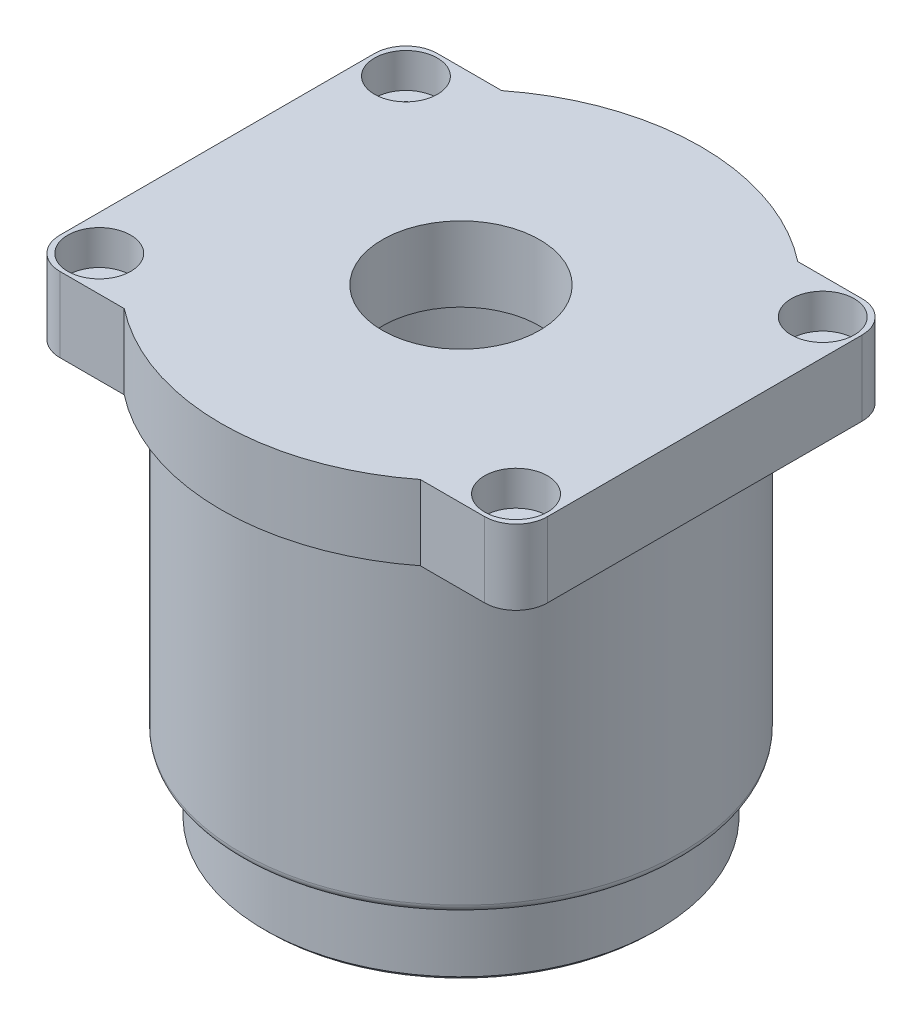
from build123d import *

# Parameters (mm, degrees)
SKICA1_R                                         = 10
P_IDAT_VYSUNUT_M1_DEPTH                          = 9.5
V_LCOV_ZAHLOUBEN_PRO_M4_ROUBY_S_VNIT_D           = 4.5
V_LCOV_ZAHLOUBEN_PRO_M4_ROUBY_S_VNIT_CBORE_D     = 8
V_LCOV_ZAHLOUBEN_PRO_M4_ROUBY_S_VNIT_CBORE_DEPTH = 4.4
LINPOLE1_COUNT                                   = 2
LINPOLE1_PITCH                                   = 53
LINPOLE1_COUNT_DIR2                              = 2
LINPOLE1_PITCH_DIR2                              = 39
SKICA4_R                                         = 28
SKICA4_R_2                                       = 20
P_IDAT_VYSUNUT_M2_DEPTH                          = 40
ZAOBLIT1_R                                       = 0.5
SKICA5_R                                         = 25
SKICA5_R_2                                       = 12.5
P_IDAT_VYSUNUT_M3_DEPTH                          = 9.5
ZAOBLIT2_R                                       = 1
ZKOSEN_1_SIZE                                    = 0.5
ODEBRAT_START                                    = -0.5
SKICA7_R                                         = 20
ODEBRAT_VYSUNUT_M1_DEPTH                         = 0.5
ZAOBLIT3_R                                       = 0.25


with BuildPart() as part:
    # Skica1 → Přidat vysunutím1 (new body)
    with BuildSketch(Plane(origin=(0, 0, 0), x_dir=(1, 0, 0), z_dir=(0, 1, 0))):
        with BuildLine():
            Line((-27, 24), (-18.821530225, 24))
            ThreePointArc((-18.821530225, 24), (0, 30.5), (18.821530225, 24))
            Line((18.821530225, 24), (27, 24))
            ThreePointArc((27, 24), (29.828427125, 22.828427125), (31, 20))
            Line((31, 20), (31, -20))
            ThreePointArc((31, -20), (29.828427125, -22.828427125), (27, -24))
            Line((27, -24), (18.821530225, -24))
            ThreePointArc((18.821530225, -24), (0, -30.5), (-18.821530225, -24))
            Line((-18.821530225, -24), (-27, -24))
            ThreePointArc((-27, -24), (-29.828427125, -22.828427125), (-31, -20))
            Line((-31, -20), (-31, 20))
            ThreePointArc((-31, 20), (-29.828427125, 22.828427125), (-27, 24))
        make_face()
        with Locations(Location((0, 0, 0), (0, 0, 270))):
            Circle(SKICA1_R, mode=Mode.SUBTRACT)
    extrude(amount=-P_IDAT_VYSUNUT_M1_DEPTH)

    # Válcové zahloubení pro M4 šrouby s vnitřním šestihranem1 (through all)
    with Locations(Plane(origin=(0, 0, 0), x_dir=(1, 0, 0), z_dir=(0, 1, 0))):
        with Locations((26.5, -19.5)):
            v_lcov_zahlouben_pro_m4_rouby_s_vnit = CounterBoreHole(V_LCOV_ZAHLOUBEN_PRO_M4_ROUBY_S_VNIT_D / 2, V_LCOV_ZAHLOUBEN_PRO_M4_ROUBY_S_VNIT_CBORE_D / 2, V_LCOV_ZAHLOUBEN_PRO_M4_ROUBY_S_VNIT_CBORE_DEPTH)

    # LinPole1: V_lcov_ zahlouben_ pro M4 _rouby s vnit 2 × 2
    with Locations(*[(-i * LINPOLE1_PITCH, 0, -j * LINPOLE1_PITCH_DIR2) for i in range(LINPOLE1_COUNT) for j in range(LINPOLE1_COUNT_DIR2) if (i, j) != (0, 0)]):
        add(v_lcov_zahlouben_pro_m4_rouby_s_vnit, mode=Mode.SUBTRACT)

    # Skica4 → Přidat vysunutím2 (add)
    with BuildSketch(Plane.XZ.offset(9.5)):
        with Locations(Location((0, 0, 0), (0, 0, 270))):
            Circle(SKICA4_R)
        with Locations(Location((0, 0, 0), (0, 0, 270))):
            Circle(SKICA4_R_2, mode=Mode.SUBTRACT)
    extrude(amount=P_IDAT_VYSUNUT_M2_DEPTH)

    # Zaoblit1
    zaoblit1_edges = [part.edges().sort_by_distance(p)[0] for p in [
        (0, -9.5, 28),
    ]]
    fillet(zaoblit1_edges, radius=ZAOBLIT1_R)

    # Zaoblit2
    zaoblit2_edges = [part.edges().sort_by_distance(p)[0] for p in [
        (0, -49.5, 28),
    ]]
    fillet(zaoblit2_edges, radius=ZAOBLIT2_R)


with BuildPart() as body_2:
    # Skica5 → Přidat vysunutím3 (new body)
    with BuildSketch(Plane.XZ.offset(49.5)):
        with Locations(Location((0, 0, 0), (0, 0, 270))):
            Circle(SKICA5_R)
        with Locations(Location((0, 0, 0), (0, 0, 270))):
            Circle(SKICA5_R_2, mode=Mode.SUBTRACT)
    extrude(amount=P_IDAT_VYSUNUT_M3_DEPTH)

    # Zkosení1
    zkosen_1_edges = [body_2.edges().sort_by_distance(p)[0] for p in [
        (0, -49.5, 25),
        (0, -59, 25),
    ]]
    chamfer(zkosen_1_edges, length=ZKOSEN_1_SIZE)

    # Skica6 → M4 závit1 (revolve, cut)
    with BuildSketch(Plane(origin=(14.89927242, -54.25, -20.075150843), x_dir=(-0.80300603370129, 0, -0.5959708968056434), z_dir=(0, 1, 0))):
        Polygon((0, 0), (0, 12.491420021), (1.65, 11.5), (1.65, 0.375), (2.025, 0), align=None)
    revolve(axis=Axis((18.683687615, -54.25, -25.174239157), (-0.5959708968056434, 0, 0.80300603370129)), mode=Mode.SUBTRACT)

    # Skica7 → Odebrat vysunutím1 (cut)
    with BuildSketch(Plane.XZ.offset(59).offset(ODEBRAT_START)):
        with Locations(Location((0, 0, 0), (0, 0, 270))):
            Circle(SKICA7_R)
    extrude(amount=ODEBRAT_VYSUNUT_M1_DEPTH, mode=Mode.SUBTRACT)

    # Zaoblit3
    zaoblit3_edges = [body_2.edges().sort_by_distance(p)[0] for p in [
        (0, -59, 20),
    ]]
    fillet(zaoblit3_edges, radius=ZAOBLIT3_R)


solid = Compound([part.part, body_2.part])
